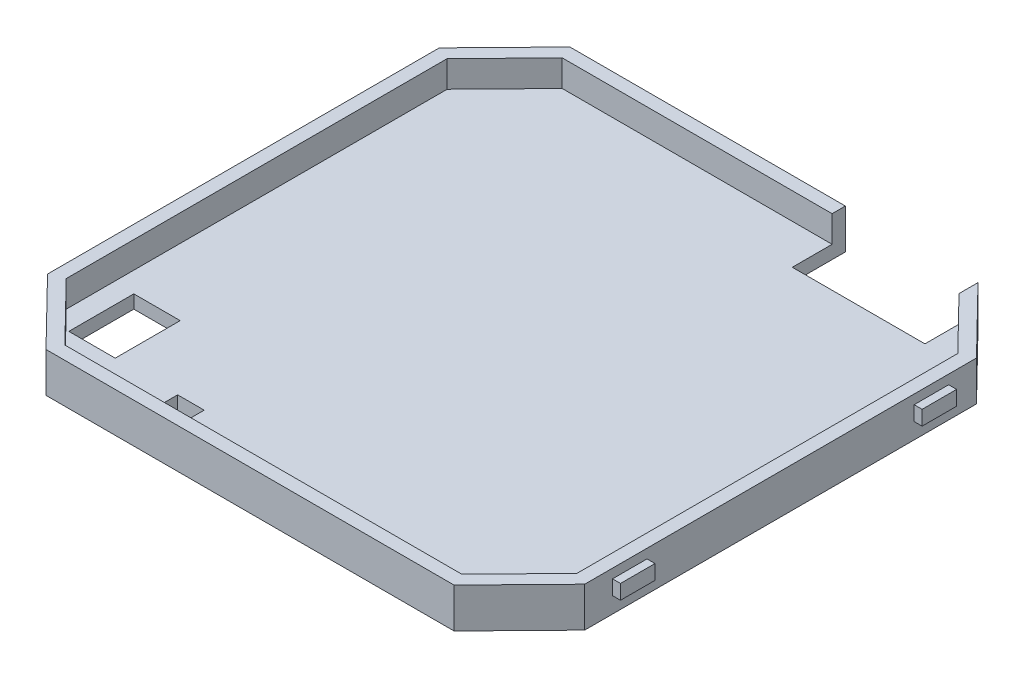
from build123d import *

# Parameters (mm, degrees)
BOSS_EXTRUDE1_DEPTH     = 1
BOSS_EXTRUDE2_START     = 1
BOSS_EXTRUDE2_DEPTH     = 2
CUT_EXTRUDE1_DEPTH      = 29.565825694
CUT_EXTRUDE1_DEPTH_BACK = 30.565825694
CUT_EXTRUDE1_START      = 1
SKETCH1_4_W             = 10
SKETCH1_4_H             = 4
SKETCH1_4_W_2           = 2
SKETCH1_4_H_2           = 3
SKETCH1_4_W_3           = 3.497046445
SKETCH1_4_H_3           = 4.9
BOSS_EXTRUDE3_START     = -20.304052
SKETCH2_W               = 2.6
SKETCH2_H               = 1.1
BOSS_EXTRUDE3_DEPTH     = 0.6
BOSS_EXTRUDE4_START     = 20.195948
SKETCH2_2_W             = 2.6
SKETCH2_2_H             = 1.1
BOSS_EXTRUDE4_DEPTH     = 0.6


with BuildPart() as part:
    # Sketch1 → Boss-Extrude1 (new body)
    with BuildSketch(Plane(origin=(0, 0, 0), x_dir=(1, 0, 0), z_dir=(0, 1, 0))):
        Polygon((-20.304052055, 14.886180374), (-20.304052055, -14.649453395), (-15.437733663, -19.631636511), (15.329629553, -19.631636511), (20.195947945, -14.649453395), (20.195947945, 14.886180374), (15.329629553, 19.868363489), (-15.437733663, 19.868363489), align=None)
    extrude(amount=BOSS_EXTRUDE1_DEPTH)

    # Sketch1<3> → Boss-Extrude2 (add)
    with BuildSketch(Plane(origin=(0, 0, 0), x_dir=(1, 0, 0), z_dir=(0, 1, 0)).offset(BOSS_EXTRUDE2_START)):
        Polygon((-20.304052055, 14.886180374), (-20.304052055, -14.649453395), (-15.437733663, -19.631636511), (15.329629553, -19.631636511), (20.195947945, -14.649453395), (20.195947945, 14.886180374), (15.329629553, 19.868363489), (-15.437733663, 19.868363489), align=None)
        Polygon((-19.304052055, 14.478841428), (-15.016611903, 18.868363489), (14.908507792, 18.868363489), (19.195947945, 14.478841428), (19.195947945, -14.24211445), (14.908507792, -18.631636511), (-15.016611903, -18.631636511), (-19.304052055, -14.24211445), align=None, mode=Mode.SUBTRACT)
    extrude(amount=BOSS_EXTRUDE2_DEPTH)

    # Sketch1<4> → Cut-Extrude1 (cut, two sides: drawn at the far end of the back side and taken through both)
    with BuildSketch(Plane(origin=(0, 0, 0), x_dir=(1, 0, 0), z_dir=(0, 1, 0)).offset(CUT_EXTRUDE1_START - CUT_EXTRUDE1_DEPTH_BACK)):
        with Locations((10.329629553, 17.868363489)):
            Rectangle(SKETCH1_4_W, SKETCH1_4_H)
        with Locations((-8.511953553, -17.131636511)):
            Rectangle(SKETCH1_4_W_2, SKETCH1_4_H_2)
        with Locations((-16.010445854, -13.139778313)):
            Rectangle(SKETCH1_4_W_3, SKETCH1_4_H_3)
    extrude(amount=CUT_EXTRUDE1_DEPTH + CUT_EXTRUDE1_DEPTH_BACK, mode=Mode.SUBTRACT)

    # Sketch2 → Boss-Extrude3 (add)
    with BuildSketch(Plane(origin=(0, 0, 0), x_dir=(0, 0, -1), z_dir=(1, 0, 0)).offset(BOSS_EXTRUDE3_START)):
        with Locations((-11.251288132, 1.75)):
            Rectangle(SKETCH2_W, SKETCH2_H)
        with Locations((11.48801511, 1.75)):
            Rectangle(SKETCH2_W, SKETCH2_H)
    extrude(amount=-BOSS_EXTRUDE3_DEPTH)

    # Sketch2<2> → Boss-Extrude4 (add)
    with BuildSketch(Plane(origin=(0, 0, 0), x_dir=(0, 0, -1), z_dir=(1, 0, 0)).offset(BOSS_EXTRUDE4_START)):
        with Locations((-11.251288132, 1.75)):
            Rectangle(SKETCH2_2_W, SKETCH2_2_H)
        with Locations((11.48801511, 1.75)):
            Rectangle(SKETCH2_2_W, SKETCH2_2_H)
    extrude(amount=BOSS_EXTRUDE4_DEPTH)


solid = part.part
